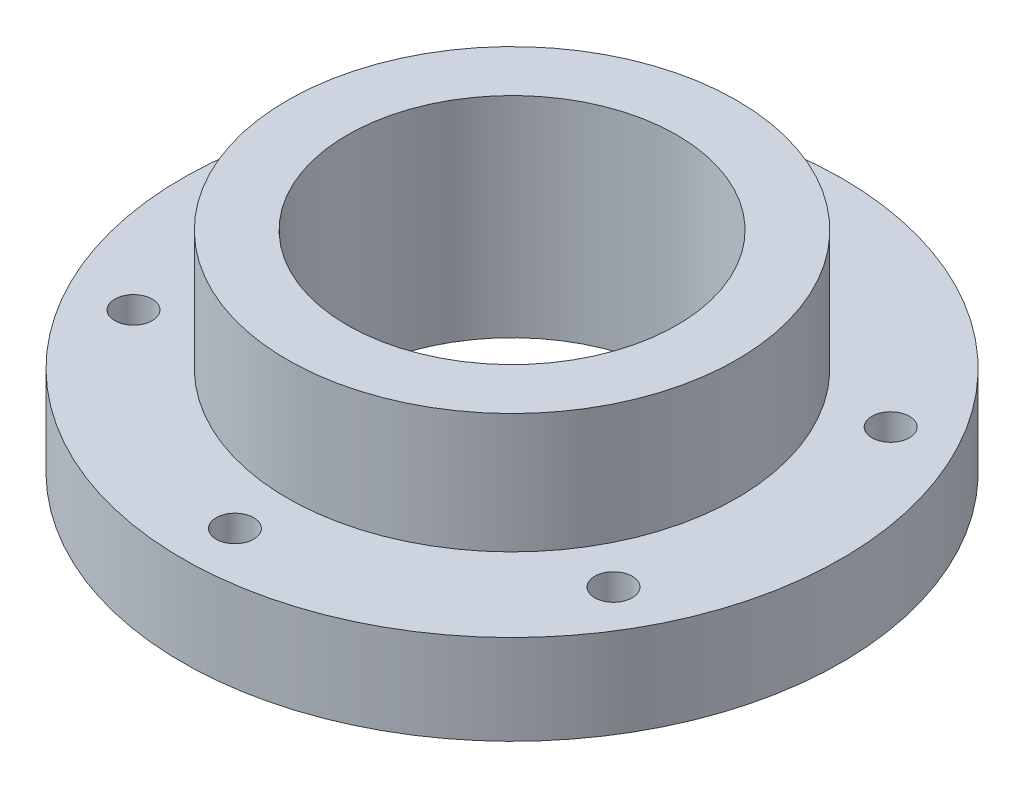
from build123d import *

# Parameters (mm, degrees)
SKETCH2_R          = 1.25
CUT_EXTRUDE1_DEPTH = 10


with BuildPart() as part:
    # Sketch1 → Revolve1 (revolve)
    with BuildSketch(Plane.XY, mode=Mode.PRIVATE) as revolve1_sk:
        Polygon((11, 0), (11, 14), (15, 14), (15, 6), (22, 6), (22, 0), align=None)
    revolve(revolve1_sk.sketch.rotate(Axis((0, 0, 0), (0, 1, 0)), 90), axis=Axis((0, 0, 0), (0, 1, 0)))

    # Sketch2 → Cut-Extrude1 (cut)
    with BuildSketch(Plane(origin=(0, 6, 0), x_dir=(1, 0, 0), z_dir=(0, 1, 0))):
        with Locations(Location((0, 18.5, 0), (0, 0, 270))):
            Circle(SKETCH2_R)
        with Locations(Location((16.02146997, 9.25, 0), (0, 0, 270))):
            Circle(SKETCH2_R)
        with Locations(Location((16.02146997, -9.25, 0), (0, 0, 270))):
            Circle(SKETCH2_R)
        with Locations(Location((0, -18.5, 0), (0, 0, 270))):
            Circle(SKETCH2_R)
        with Locations(Location((-16.02146997, -9.25, 0), (0, 0, 270))):
            Circle(SKETCH2_R)
        with Locations(Location((-16.02146997, 9.25, 0), (0, 0, 270))):
            Circle(SKETCH2_R)
    extrude(amount=-CUT_EXTRUDE1_DEPTH, mode=Mode.SUBTRACT)


solid = part.part
